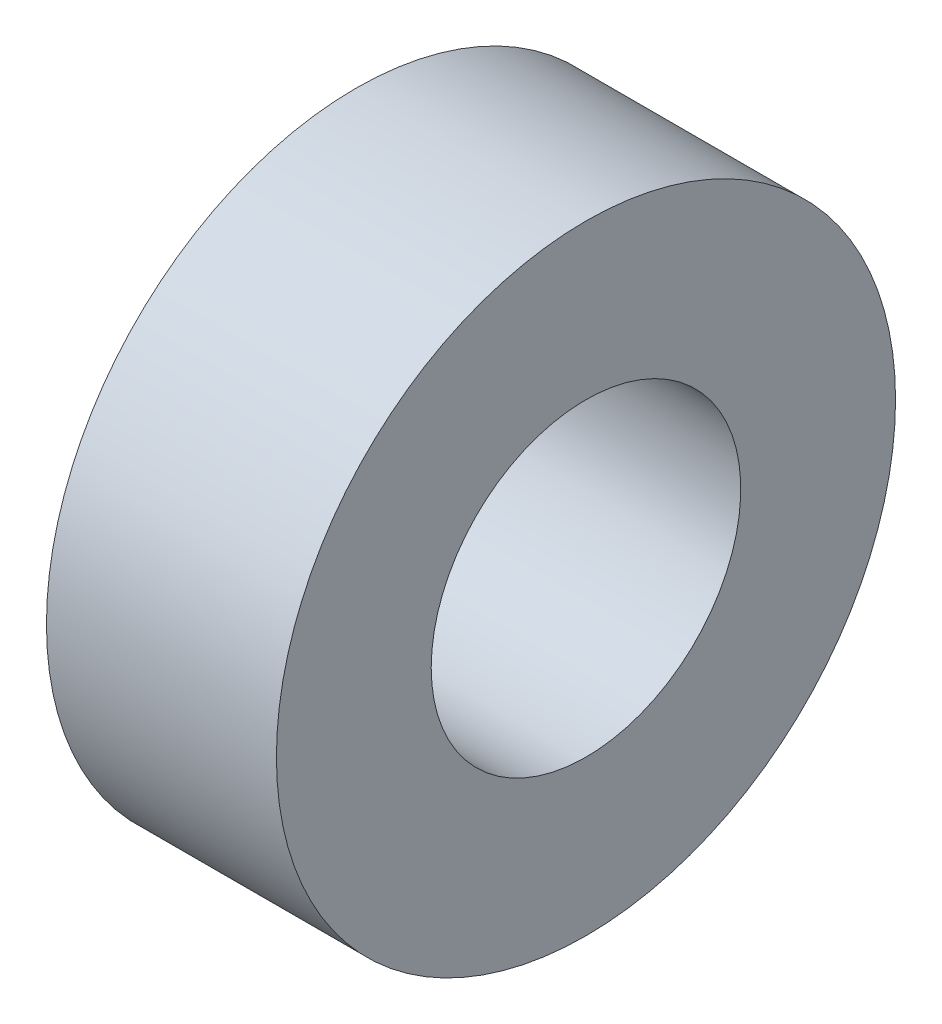
from build123d import *

# Parameters (mm, degrees)
SKETCH15_W   = 26
SKETCH15_H   = 35
SKETCH16_W   = 26
SKETCH16_H   = 17.5
SCALE1_SCALE = 0.1


with BuildPart() as part:
    # Sketch15 → Revolve1 (revolve)
    with BuildSketch(Plane.XY, mode=Mode.PRIVATE) as revolve1_sk:
        with Locations((864, 1478.5)):
            Rectangle(SKETCH15_W, SKETCH15_H)
    revolve(revolve1_sk.sketch.rotate(Axis((851, 1461, 0), (1, 0, 0)), 90), axis=Axis((851, 1461, 0), (1, 0, 0)))

    # Sketch16 → Cut-Revolve1 (revolve, cut)
    with BuildSketch(Plane.XY, mode=Mode.PRIVATE) as cut_revolve1_sk:
        with Locations((864, 1469.75)):
            Rectangle(SKETCH16_W, SKETCH16_H)
    revolve(cut_revolve1_sk.sketch.rotate(Axis((851, 1461, 0), (1, 0, 0)), 90), axis=Axis((851, 1461, 0), (1, 0, 0)), mode=Mode.SUBTRACT)


with BuildPart() as part_1:
    # Scale1: scaled about (0, 0, 0)
    add(part.part.scale(SCALE1_SCALE))


solid = part_1.part
